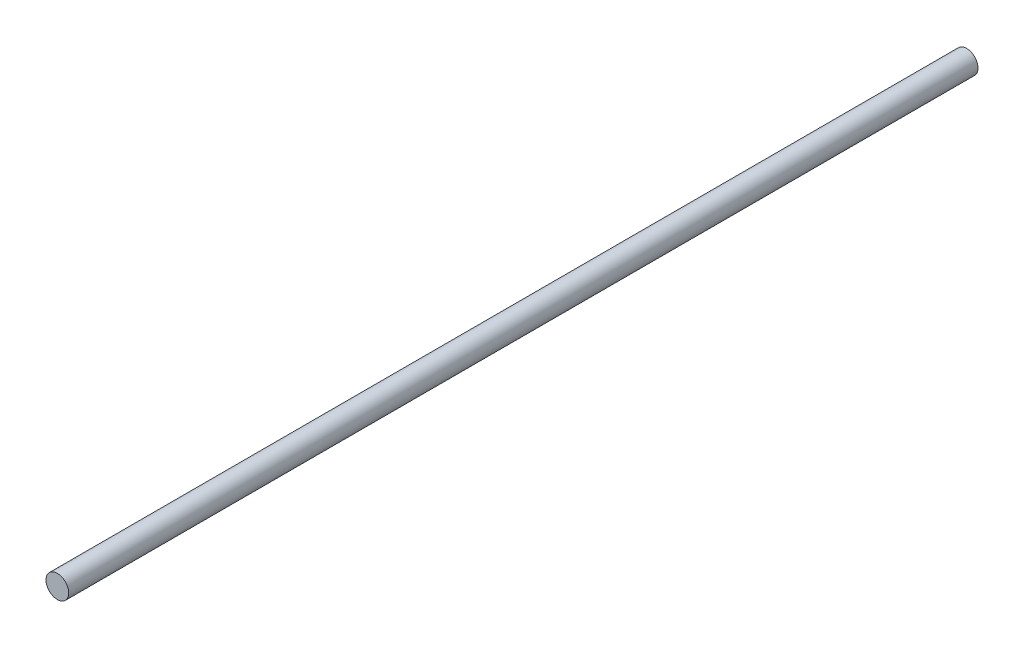
from build123d import *

# Parameters (mm, degrees)
ESQUISSE1_R        = 7.5
BOSS_EXTRU_1_DEPTH = 600


with BuildPart() as part:
    # Esquisse1 → Boss.-Extru.1 (new body)
    with BuildSketch(Plane.XY):
        Circle(ESQUISSE1_R)
    extrude(amount=BOSS_EXTRU_1_DEPTH)


solid = part.part
